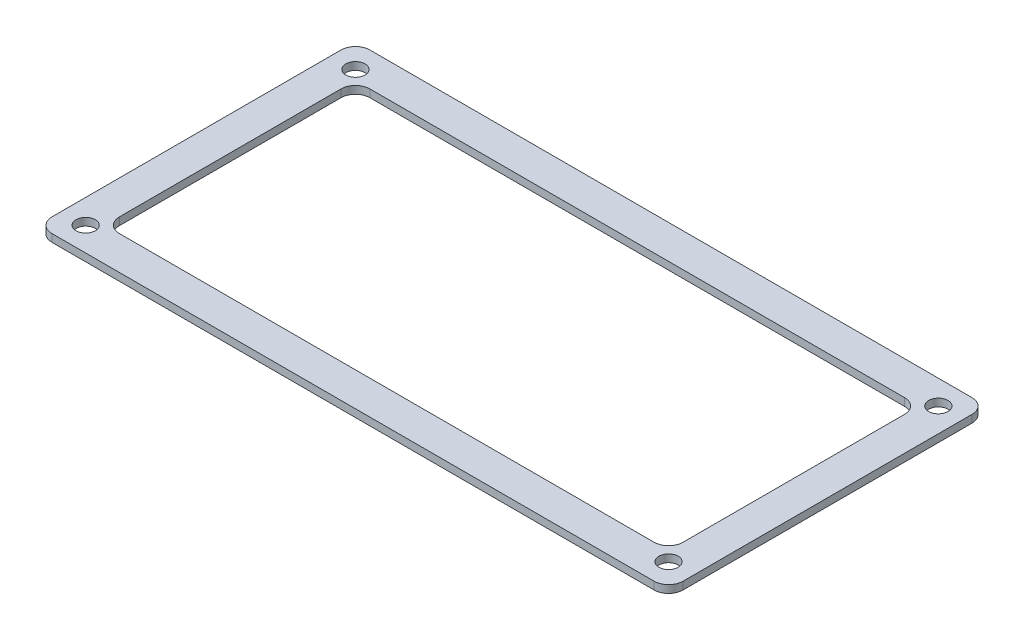
from build123d import *

# Parameters (mm, degrees)
SKETCH1_W           = 131
SKETCH1_H           = 66
BOSS_EXTRUDE1_DEPTH = 1.5875
SKETCH3_W           = 117
SKETCH3_H           = 52
CUT_EXTRUDE2_DEPTH  = 74.360549045
SKETCH4_R           = 2
CUT_EXTRUDE3_DEPTH  = 74.360549045
FILLET1_R           = 3


with BuildPart() as part:
    # Sketch1 → Boss-Extrude1 (new body)
    with BuildSketch(Plane(origin=(0, 0, 0), x_dir=(1, 0, 0), z_dir=(0, 1, 0))):
        Rectangle(SKETCH1_W, SKETCH1_H)
    extrude(amount=BOSS_EXTRUDE1_DEPTH)

    # Sketch3 → Cut-Extrude2 (cut, through all)
    with BuildSketch(Plane(origin=(0, 1.5875, 0), x_dir=(1, 0, 0), z_dir=(0, 1, 0))):
        Rectangle(SKETCH3_W, SKETCH3_H)
    extrude(amount=-CUT_EXTRUDE2_DEPTH, mode=Mode.SUBTRACT)

    # Sketch4 → Cut-Extrude3 (cut, through all)
    with BuildSketch(Plane(origin=(0, 1.5875, 0), x_dir=(1, 0, 0), z_dir=(0, 1, 0))):
        with Locations(Location((-60.5, 28, 0), (0, 0, 270))):
            Circle(SKETCH4_R)
        with Locations(Location((60.5, 28, 0), (0, 0, 270))):
            Circle(SKETCH4_R)
        with Locations(Location((60.5, -28, 0), (0, 0, 270))):
            Circle(SKETCH4_R)
        with Locations(Location((-60.5, -28, 0), (0, 0, 270))):
            Circle(SKETCH4_R)
    extrude(amount=-CUT_EXTRUDE3_DEPTH, mode=Mode.SUBTRACT)

    # Fillet1
    fillet1_edges = [part.edges().sort_by_distance(p)[0] for p in [
        (-58.5, 0.79375, 26),
        (-58.5, 0.79375, -26),
        (58.5, 0.79375, -26),
        (58.5, 0.79375, 26),
        (-65.5, 0.79375, -33),
        (65.5, 0.79375, -33),
        (65.5, 0.79375, 33),
        (-65.5, 0.79375, 33),
    ]]
    fillet(fillet1_edges, radius=FILLET1_R)


solid = part.part
